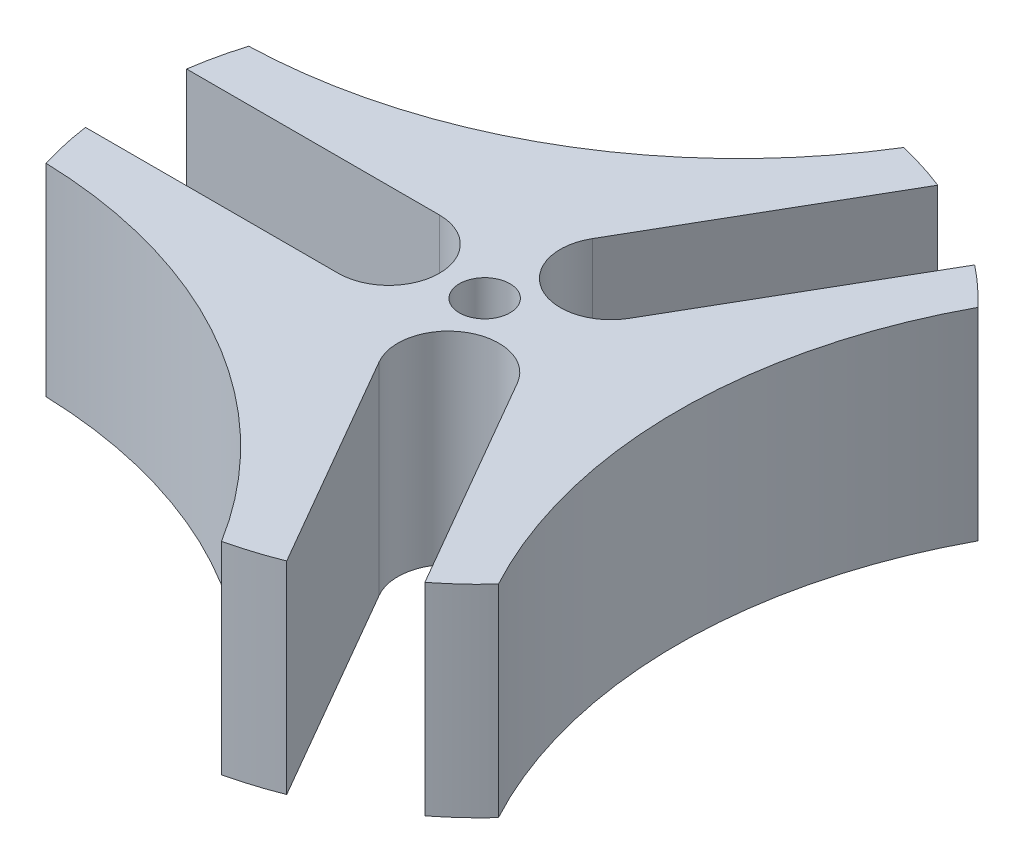
from build123d import *

# Parameters (mm, degrees)
SKETCH_1_R      = 1.25
EXTRUDE_1_DEPTH = 10


with BuildPart() as part:
    # 草圖1 → 填料-伸長1 (new body)
    with BuildSketch(Plane(origin=(0, 0, 0), x_dir=(1, 0, 0), z_dir=(0, 1, 0))):
        with BuildLine():
            Line((0.155444566, 5.269237886), (6.404504741, 16.092927609))
            ThreePointArc((6.404504741, 16.092927609), (5.191725275, 16.524103264), (3.950274568, 16.864024752))
            ThreePointArc((3.950274568, 16.864024752), (-4.820507676, 8.349364213), (-16.579811129, 5.010974248))
            ThreePointArc((-16.579811129, 5.010974248), (-16.906155839, 3.765885654), (-17.139136501, 2.5))
            Line((-17.139136501, 2.5), (-4.641016151, 2.5))
            ThreePointArc((-4.641016151, 2.5), (-2.141016151, 0), (-4.641016151, -2.5))
            Line((-4.641016151, -2.5), (-17.139136501, -2.5))
            ThreePointArc((-17.139136501, -2.5), (-16.906155839, -3.765885654), (-16.579811129, -5.010974248))
            ThreePointArc((-16.579811129, -5.010974248), (-4.820507676, -8.349364213), (3.950274568, -16.864024752))
            ThreePointArc((3.950274568, -16.864024752), (5.191725275, -16.524103264), (6.404504741, -16.092927609))
            Line((6.404504741, -16.092927609), (0.155444566, -5.269237886))
            ThreePointArc((0.155444566, -5.269237886), (1.070508076, -1.854174377), (4.485571585, -2.769237886))
            Line((4.485571585, -2.769237886), (10.73463176, -13.592927609))
            ThreePointArc((10.73463176, -13.592927609), (11.714430563, -12.75821761), (12.629536561, -11.853050504))
            ThreePointArc((12.629536561, -11.853050504), (9.641015352, 0), (12.629536561, 11.853050504))
            ThreePointArc((12.629536561, 11.853050504), (11.714430563, 12.75821761), (10.73463176, 13.592927609))
            Line((10.73463176, 13.592927609), (4.485571585, 2.769237886))
            ThreePointArc((4.485571585, 2.769237886), (1.070508076, 1.854174377), (0.155444566, 5.269237886))
        make_face()
        with Locations(Location((0.048558271, 0.050271222, 0), (0, 0, 270))):
            Circle(SKETCH_1_R, mode=Mode.SUBTRACT)
    extrude(amount=EXTRUDE_1_DEPTH)


solid = part.part
